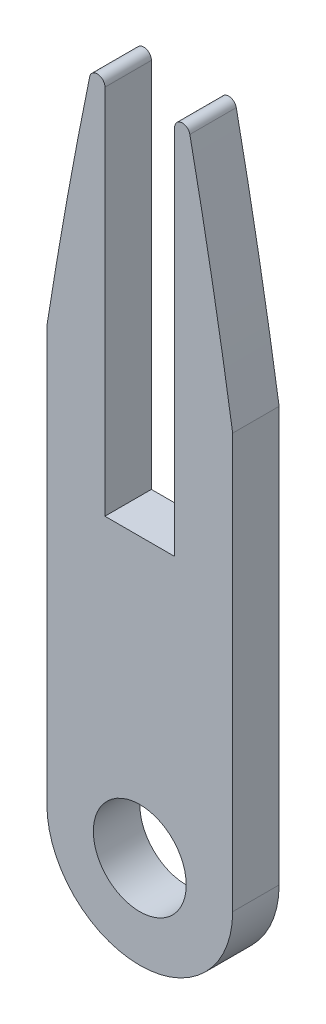
from build123d import *

# Parameters (mm, degrees)
SKETCH1_R           = 12.7
BOSS_EXTRUDE1_DEPTH = 6.35


with BuildPart() as part:
    # Sketch1 → Boss-Extrude1 (new, symmetric)
    # profile 1 of 3: a face of its own
    with BuildSketch(Plane.XY):
        with BuildLine():
            Line((-9.525, 76.2), (-9.525, 136.886260676))
            ThreePointArc((-9.525, 136.886260676), (-18.575269818, 130.663783585), (-24.152491502, 121.202219064))
            ThreePointArc((-24.152491502, 121.202219064), (-24.781960517, 117.271931521), (-25.4, 113.33983048))
            Line((-25.4, 113.33983048), (-25.4, 0))
            ThreePointArc((-25.4, 0), (0, -25.4), (25.4, 0))
            Line((25.4, 0), (25.4, 113.33983048))
            ThreePointArc((25.4, 113.33983048), (24.781960517, 117.271931521), (24.152491502, 121.202219064))
            ThreePointArc((24.152491502, 121.202219064), (18.575269818, 130.663783585), (9.525, 136.886260676))
            Line((9.525, 136.886260676), (9.525, 76.2))
            Line((9.525, 76.2), (-9.525, 76.2))
        make_face()
        Circle(SKETCH1_R, mode=Mode.SUBTRACT)
    # profile 2 of 3: a face of its own
    with BuildSketch(Plane.XY):
        with BuildLine():
            Line((9.525, 177.8), (9.525, 136.886260676))
            ThreePointArc((9.525, 136.886260676), (18.575269818, 130.663783585), (24.152491502, 121.202219064))
            ThreePointArc((24.152491502, 121.202219064), (19.223916585, 149.768263862), (13.691628219, 178.22355426))
            ThreePointArc((13.691628219, 178.22355426), (11.416973573, 179.894050437), (9.525, 177.8))
        make_face()
    # profile 3 of 3: a face of its own
    with BuildSketch(Plane.XY):
        with BuildLine():
            Line((-9.525, 136.886260676), (-9.525, 177.8))
            ThreePointArc((-9.525, 177.8), (-11.416973573, 179.894050437), (-13.691628219, 178.22355426))
            ThreePointArc((-13.691628219, 178.22355426), (-19.223916585, 149.768263862), (-24.152491502, 121.202219064))
            ThreePointArc((-24.152491502, 121.202219064), (-18.575269818, 130.663783585), (-9.525, 136.886260676))
        make_face()
    extrude(amount=BOSS_EXTRUDE1_DEPTH, both=True)


solid = part.part
